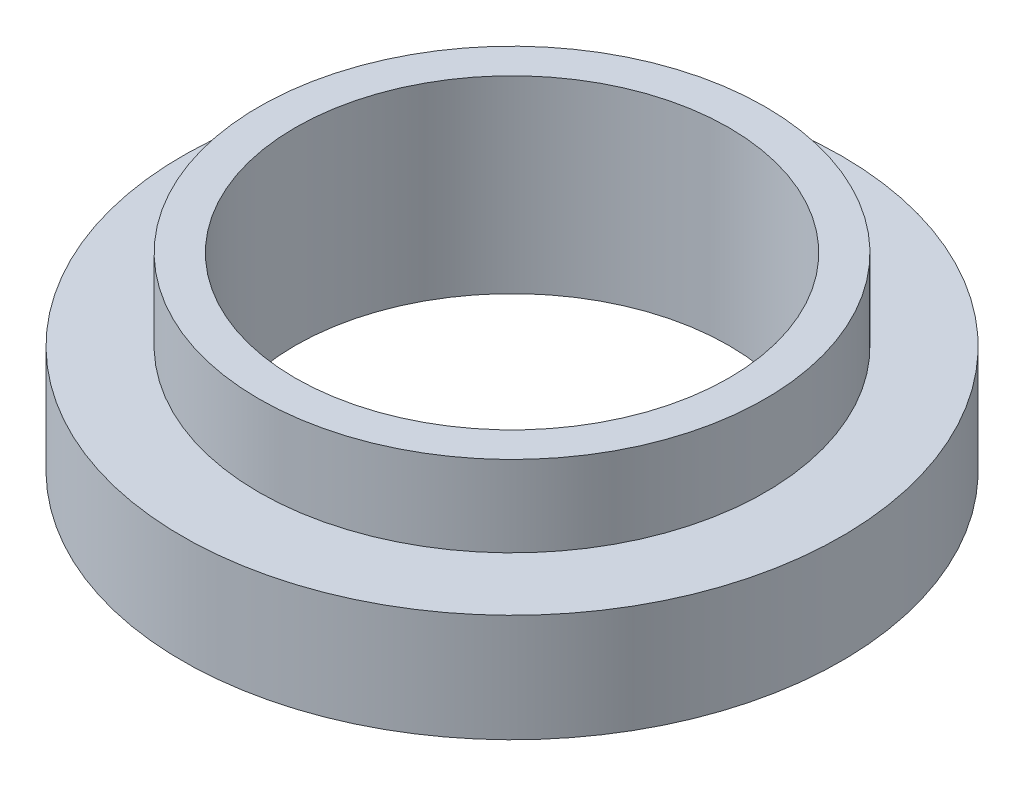
from build123d import *


with BuildPart() as part:
    # Sketch1 → Revolve1 (revolve)
    with BuildSketch(Plane.XY, mode=Mode.PRIVATE) as revolve1_sk:
        Polygon((-31.85, 15.83333352), (-31.85, 43.543777957), (-37.17, 43.543777957), (-37.17, 31.666666853), (-48.4, 31.666666853), (-48.4, 15.83333352), (-40.710440568, 15.83333352), align=None)
    revolve(revolve1_sk.sketch.rotate(Axis((0, 0, 0), (0, 1, 0)), 270), axis=Axis((0, 0, 0), (0, 1, 0)))


solid = part.part
